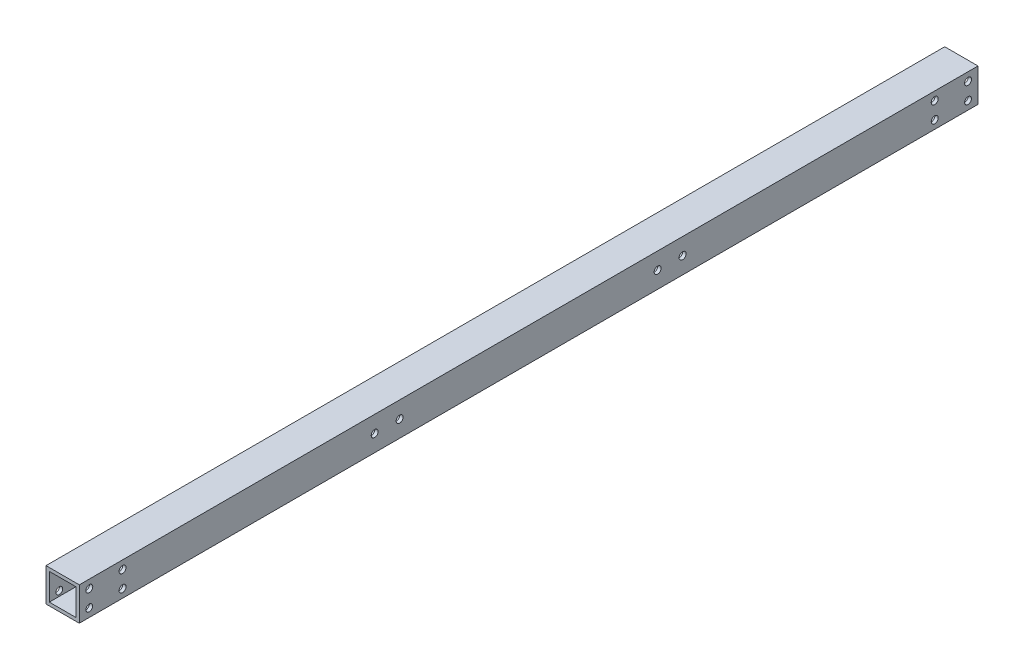
from build123d import *

# Parameters (mm, degrees)
SKETCH_1_W          = 20
SKETCH_1_H          = 20
SKETCH_1_W_2        = 16
SKETCH_1_H_2        = 16
EXTRUDE_1_DEPTH     = 560
SKETCH_2_W          = 20
SKETCH_2_H          = 20
CUT_EXTRUDE_1_DEPTH = 10
SKETCH_3_R          = 2.1
SKETCH_3_R_2        = 2.035272785
CUT_EXTRUDE_2_DEPTH = 551.454357781
SKETCH_4_R          = 2.1
CUT_EXTRUDE_3_DEPTH = 551.454357781


with BuildPart() as part:
    # 草图1 → 凸台-拉伸1 (new body)
    with BuildSketch(Plane.XY):
        Rectangle(SKETCH_1_W, SKETCH_1_H)
        Rectangle(SKETCH_1_W_2, SKETCH_1_H_2, mode=Mode.SUBTRACT)
    extrude(amount=EXTRUDE_1_DEPTH)

    # 草图2 → 切除-拉伸1 (cut)
    with BuildSketch(Plane(origin=(0, 0, 0), x_dir=(-1, 0, 0), z_dir=(0, 0, -1))):
        Rectangle(SKETCH_2_W, SKETCH_2_H)
    cut_extrude_1 = extrude(amount=-CUT_EXTRUDE_1_DEPTH, mode=Mode.SUBTRACT)

    # 镜向1: 切除-拉伸1 across plane
    add(cut_extrude_1.mirror(Plane(origin=(-40, 280, 280), x_dir=(1, 0, 0), z_dir=(0, 0, 1))), mode=Mode.SUBTRACT)

    # 草图3 → 切除-拉伸2 (cut, through all)
    with BuildSketch(Plane(origin=(10, 0, 0), x_dir=(0, 0, -1), z_dir=(1, 0, 0))):
        with Locations((-16, 5)):
            Circle(SKETCH_3_R)
        with Locations((-16, -5)):
            Circle(SKETCH_3_R_2)
        with Locations((-36, 5)):
            Circle(SKETCH_3_R)
        with Locations((-36, -5)):
            Circle(SKETCH_3_R)
        with Locations((-544, 5)):
            Circle(SKETCH_3_R)
        with Locations((-544, -5)):
            Circle(SKETCH_3_R_2)
        with Locations((-524, -5)):
            Circle(SKETCH_3_R)
        with Locations((-524, 5)):
            Circle(SKETCH_3_R)
    extrude(amount=-CUT_EXTRUDE_2_DEPTH, mode=Mode.SUBTRACT)

    # 草图4 → 切除-拉伸3 (cut, through all)
    with BuildSketch(Plane(origin=(10, 0, 0), x_dir=(0, 0, -1), z_dir=(1, 0, 0))):
        with Locations((-187.5, 0)):
            Circle(SKETCH_4_R)
        with Locations((-202.5, 0)):
            Circle(SKETCH_4_R)
        with Locations((-357.5, 0)):
            Circle(SKETCH_4_R)
        with Locations((-372.5, 0)):
            Circle(SKETCH_4_R)
    extrude(amount=-CUT_EXTRUDE_3_DEPTH, mode=Mode.SUBTRACT)


solid = part.part
